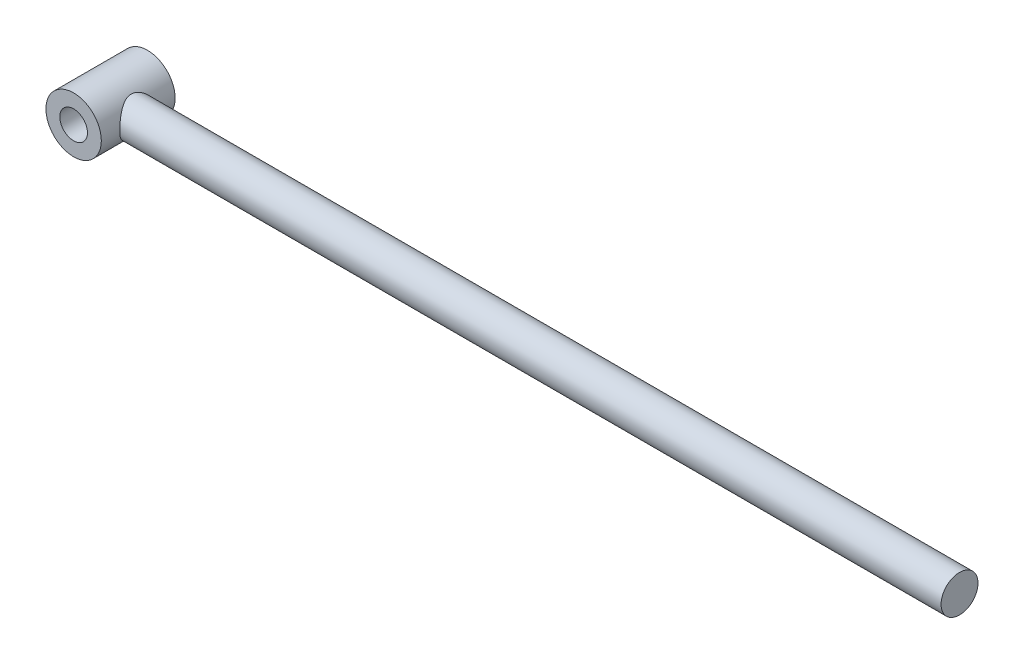
from build123d import *

# Parameters (mm, degrees)
SKETCH1_R           = 30
SKETCH1_R_2         = 15
BOSS_EXTRUDE1_DEPTH = 40
SKETCH3_R           = 20
BOSS_EXTRUDE2_DEPTH = 900


with BuildPart() as part:
    # Sketch1 → Boss-Extrude1 (new, symmetric)
    with BuildSketch(Plane.XY):
        Circle(SKETCH1_R)
        Circle(SKETCH1_R_2, mode=Mode.SUBTRACT)
    extrude(amount=BOSS_EXTRUDE1_DEPTH, both=True)

    # Sketch3 → Boss-Extrude2 (add)
    with BuildSketch(Plane(origin=(20, 0, 0), x_dir=(0, 0, -1), z_dir=(1, 0, 0))):
        Circle(SKETCH3_R)
    extrude(amount=BOSS_EXTRUDE2_DEPTH)


solid = part.part
